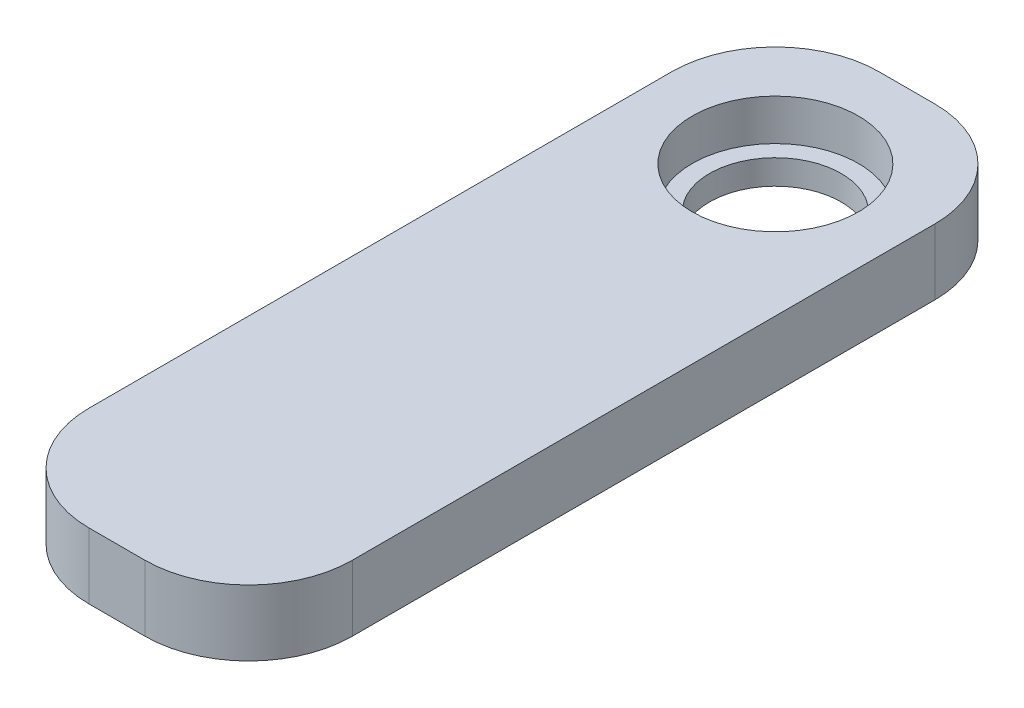
from build123d import *

# Parameters (mm, degrees)
SKETCH1_W           = 25.4
SKETCH1_H           = 76.2
BOSS_EXTRUDE1_DEPTH = 6.35
SKETCH5_R           = 8.016875
CUT_EXTRUDE1_DEPTH  = 3.96875
SKETCH6_R           = 6.35
CUT_EXTRUDE2_DEPTH  = 81.419841933
SKETCH7_R           = 3.429
CUT_EXTRUDE3_DEPTH  = 7.62
SKETCH9_W           = 11.198432991
SKETCH9_H           = 1.819618823
BOSS_EXTRUDE2_DEPTH = 6.35
BOSS_EXTRUDE4_START = -6.35
SKETCH11_W          = 13.636513595
SKETCH11_H          = 8.31497605
BOSS_EXTRUDE4_DEPTH = 1.27
FILLET1_R           = 10


with BuildPart() as part:
    # Sketch1 → Boss-Extrude1 (new body)
    with BuildSketch(Plane(origin=(0, 0, 0), x_dir=(1, 0, 0), z_dir=(0, 1, 0))):
        with Locations((12.7, 38.1)):
            Rectangle(SKETCH1_W, SKETCH1_H)
    extrude(amount=BOSS_EXTRUDE1_DEPTH)

    # Sketch5 → Cut-Extrude1 (cut)
    with BuildSketch(Plane(origin=(0, 6.35, 0), x_dir=(1, 0, 0), z_dir=(0, 1, 0))):
        with Locations(Location((12.7, 63.5, 0), (0, 0, 270))):
            Circle(SKETCH5_R)
    extrude(amount=-CUT_EXTRUDE1_DEPTH, mode=Mode.SUBTRACT)

    # Sketch6 → Cut-Extrude2 (cut, through all)
    with BuildSketch(Plane(origin=(0, 2.38125, 0), x_dir=(1, 0, 0), z_dir=(0, 1, 0))):
        with Locations(Location((12.7, 63.5, 0), (0, 0, 270))):
            Circle(SKETCH6_R)
    extrude(amount=-CUT_EXTRUDE2_DEPTH, mode=Mode.SUBTRACT)

    # Sketch7 → Cut-Extrude3 (cut)
    with BuildSketch(Plane(origin=(0, 6.35, 0), x_dir=(1, 0, 0), z_dir=(0, 1, 0))):
        with Locations(Location((12.7, 6.35, 0), (0, 0, 270))):
            Circle(SKETCH7_R)
    extrude(amount=-CUT_EXTRUDE3_DEPTH, mode=Mode.SUBTRACT)

    # Sketch9 → Boss-Extrude2 (add, through all)
    with BuildSketch(Plane(origin=(0, 6.35, 0), x_dir=(1, 0, 0), z_dir=(0, 1, 0))):
        with Locations((12.325928429, 9.647409411)):
            Rectangle(SKETCH9_W, SKETCH9_H)
    extrude(amount=-BOSS_EXTRUDE2_DEPTH)

    # Sketch11 → Boss-Extrude4 (add)
    with BuildSketch(Plane.XZ.offset(BOSS_EXTRUDE4_START)):
        with Locations((12.44089651, -6.12924614)):
            Rectangle(SKETCH11_W, SKETCH11_H)
    extrude(amount=BOSS_EXTRUDE4_DEPTH)

    # Fillet1
    fillet1_edges = [part.edges().sort_by_distance(p)[0] for p in [
        (0, 3.175, -76.2),
        (25.4, 3.175, -76.2),
        (25.4, 3.175, 0),
        (0, 3.175, 0),
    ]]
    fillet(fillet1_edges, radius=FILLET1_R)


solid = part.part
